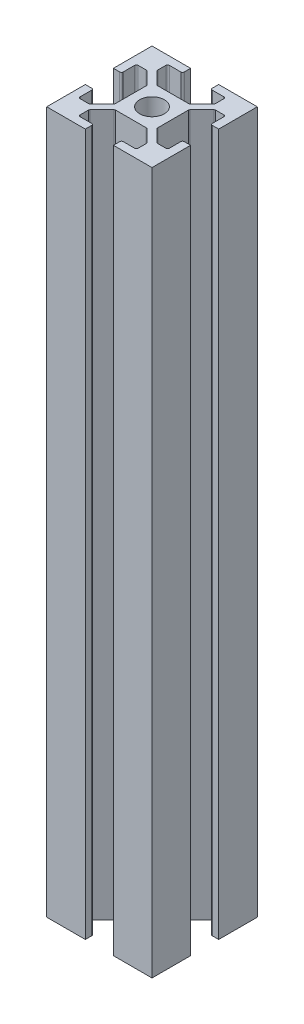
from build123d import *

# Parameters (mm, degrees)
CROQUIS1_W              = 30
CROQUIS1_H              = 30
SALIENTE_EXTRUIR1_DEPTH = 200
CROQUIS3_R              = 3.5
CORTAR_EXTRUIR2_DEPTH   = 202.121853611


with BuildPart() as part:
    # Croquis1 → Saliente-Extruir1 (new body)
    with BuildSketch(Plane(origin=(0, 0, 0), x_dir=(1, 0, 0), z_dir=(0, 1, 0))):
        Rectangle(CROQUIS1_W, CROQUIS1_H)
    extrude(amount=SALIENTE_EXTRUIR1_DEPTH)

    # Croquis3 → Cortar-Extruir2 (cut, through all)
    with BuildSketch(Plane(origin=(0, 200, 0), x_dir=(1, 0, 0), z_dir=(0, 1, 0))):
        with Locations(Location((0, 0, 0), (0, 0, 270))):
            Circle(CROQUIS3_R)
        with BuildLine():
            Line((4, 15), (-4, 15))
            Line((-4, 15), (-4, 13.2))
            ThreePointArc((-4, 13.2), (-4.146446609, 12.846446609), (-4.5, 12.7))
            Line((-4.5, 12.7), (-7.75, 12.7))
            ThreePointArc((-7.75, 12.7), (-8.103553391, 12.553553391), (-8.25, 12.2))
            Line((-8.25, 12.2), (-8.25, 9.907106781))
            ThreePointArc((-8.25, 9.907106781), (-8.211939766, 9.715765065), (-8.103553391, 9.553553391))
            Line((-8.103553391, 9.553553391), (-4.696446609, 6.146446609))
            ThreePointArc((-4.696446609, 6.146446609), (-4.534234935, 6.038060234), (-4.342893219, 6))
            Line((-4.342893219, 6), (4.342893219, 6))
            ThreePointArc((4.342893219, 6), (4.534234935, 6.038060234), (4.696446609, 6.146446609))
            Line((4.696446609, 6.146446609), (8.103553391, 9.553553391))
            ThreePointArc((8.103553391, 9.553553391), (8.211939766, 9.715765065), (8.25, 9.907106781))
            Line((8.25, 9.907106781), (8.25, 12.2))
            ThreePointArc((8.25, 12.2), (8.103553391, 12.553553391), (7.75, 12.7))
            Line((7.75, 12.7), (4.5, 12.7))
            ThreePointArc((4.5, 12.7), (4.146446609, 12.846446609), (4, 13.2))
            Line((4, 13.2), (4, 15))
        make_face()
        with BuildLine():
            Line((6, 4.342893219), (6, -4.342893219))
            ThreePointArc((6, -4.342893219), (6.038060234, -4.534234935), (6.146446609, -4.696446609))
            Line((6.146446609, -4.696446609), (9.553553391, -8.103553391))
            ThreePointArc((9.553553391, -8.103553391), (9.715765065, -8.211939766), (9.907106781, -8.25))
            Line((9.907106781, -8.25), (12.2, -8.25))
            ThreePointArc((12.2, -8.25), (12.553553391, -8.103553391), (12.7, -7.75))
            Line((12.7, -7.75), (12.7, -4.5))
            ThreePointArc((12.7, -4.5), (12.846446609, -4.146446609), (13.2, -4))
            Line((13.2, -4), (15, -4))
            Line((15, -4), (15, 4))
            Line((15, 4), (13.2, 4))
            ThreePointArc((13.2, 4), (12.846446609, 4.146446609), (12.7, 4.5))
            Line((12.7, 4.5), (12.7, 7.75))
            ThreePointArc((12.7, 7.75), (12.553553391, 8.103553391), (12.2, 8.25))
            Line((12.2, 8.25), (9.907106781, 8.25))
            ThreePointArc((9.907106781, 8.25), (9.715765065, 8.211939766), (9.553553391, 8.103553391))
            Line((9.553553391, 8.103553391), (6.146446609, 4.696446609))
            ThreePointArc((6.146446609, 4.696446609), (6.038060234, 4.534234935), (6, 4.342893219))
        make_face()
        with BuildLine():
            Line((4.342893219, -6), (-4.342893219, -6))
            ThreePointArc((-4.342893219, -6), (-4.534234935, -6.038060234), (-4.696446609, -6.146446609))
            Line((-4.696446609, -6.146446609), (-8.103553391, -9.553553391))
            ThreePointArc((-8.103553391, -9.553553391), (-8.211939766, -9.715765065), (-8.25, -9.907106781))
            Line((-8.25, -9.907106781), (-8.25, -12.2))
            ThreePointArc((-8.25, -12.2), (-8.103553391, -12.553553391), (-7.75, -12.7))
            Line((-7.75, -12.7), (-4.5, -12.7))
            ThreePointArc((-4.5, -12.7), (-4.146446609, -12.846446609), (-4, -13.2))
            Line((-4, -13.2), (-4, -15))
            Line((-4, -15), (4, -15))
            Line((4, -15), (4, -13.2))
            ThreePointArc((4, -13.2), (4.146446609, -12.846446609), (4.5, -12.7))
            Line((4.5, -12.7), (7.75, -12.7))
            ThreePointArc((7.75, -12.7), (8.103553391, -12.553553391), (8.25, -12.2))
            Line((8.25, -12.2), (8.25, -9.907106781))
            ThreePointArc((8.25, -9.907106781), (8.211939766, -9.715765065), (8.103553391, -9.553553391))
            Line((8.103553391, -9.553553391), (4.696446609, -6.146446609))
            ThreePointArc((4.696446609, -6.146446609), (4.534234935, -6.038060234), (4.342893219, -6))
        make_face()
        with BuildLine():
            Line((-6, -4.342893219), (-6, 4.342893219))
            ThreePointArc((-6, 4.342893219), (-6.038060234, 4.534234935), (-6.146446609, 4.696446609))
            Line((-6.146446609, 4.696446609), (-9.553553391, 8.103553391))
            ThreePointArc((-9.553553391, 8.103553391), (-9.715765065, 8.211939766), (-9.907106781, 8.25))
            Line((-9.907106781, 8.25), (-12.2, 8.25))
            ThreePointArc((-12.2, 8.25), (-12.553553391, 8.103553391), (-12.7, 7.75))
            Line((-12.7, 7.75), (-12.7, 4.5))
            ThreePointArc((-12.7, 4.5), (-12.846446609, 4.146446609), (-13.2, 4))
            Line((-13.2, 4), (-15, 4))
            Line((-15, 4), (-15, -4))
            Line((-15, -4), (-13.2, -4))
            ThreePointArc((-13.2, -4), (-12.846446609, -4.146446609), (-12.7, -4.5))
            Line((-12.7, -4.5), (-12.7, -7.75))
            ThreePointArc((-12.7, -7.75), (-12.553553391, -8.103553391), (-12.2, -8.25))
            Line((-12.2, -8.25), (-9.907106781, -8.25))
            ThreePointArc((-9.907106781, -8.25), (-9.715765065, -8.211939766), (-9.553553391, -8.103553391))
            Line((-9.553553391, -8.103553391), (-6.146446609, -4.696446609))
            ThreePointArc((-6.146446609, -4.696446609), (-6.038060234, -4.534234935), (-6, -4.342893219))
        make_face()
    extrude(amount=-CORTAR_EXTRUIR2_DEPTH, mode=Mode.SUBTRACT)


solid = part.part
